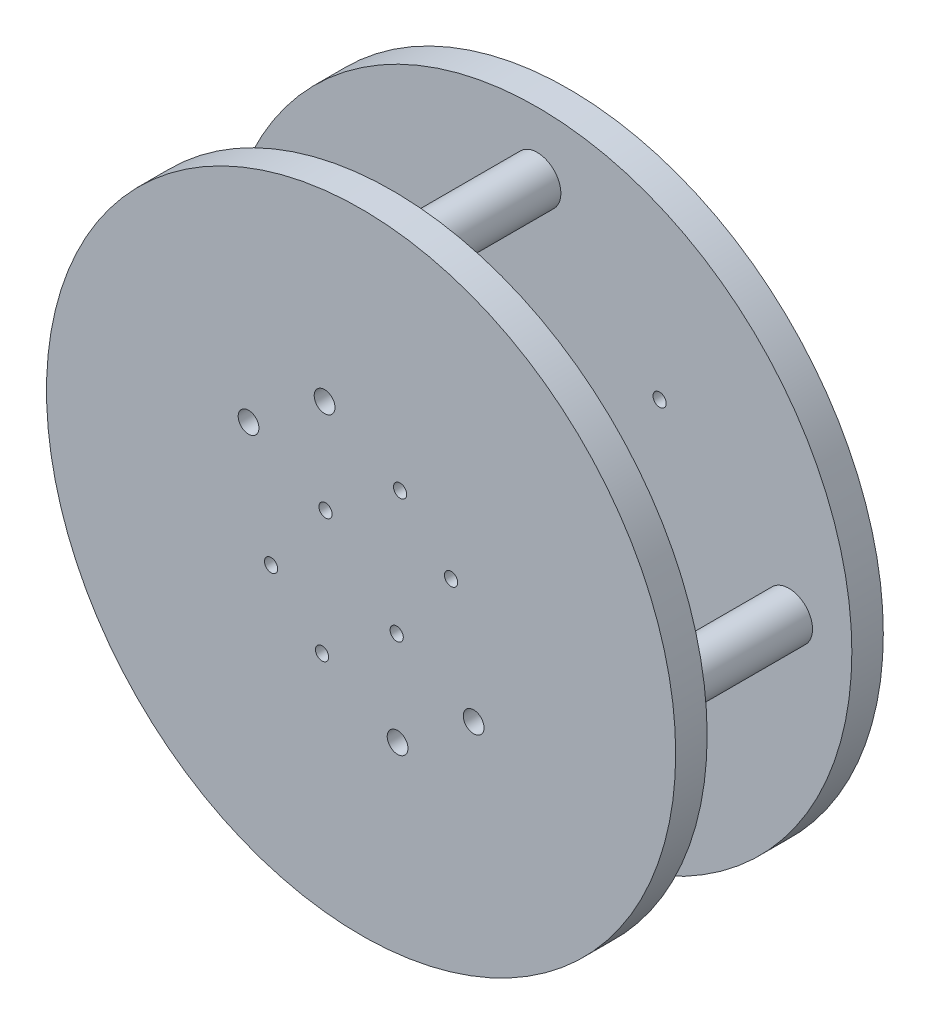
from build123d import *

# Parameters (mm, degrees)
SKETCH_1_R               = 100
EXTRUDE_1_DEPTH          = 10
SKETCH_12_R              = 7.5
EXTRUDE_3_DEPTH          = 46
SKETCH_14_R              = 100
EXTRUDE_4_DEPTH          = 10
SKETCH_15_R              = 2.1
CUT_EXTRUDE_7_DEPTH      = 10
SKETCH_15_3_R            = 2.1
CUT_EXTRUDE_8_DEPTH      = 157.064089399
SKETCH_18_R              = 3.3
CUT_EXTRUDE_9_DEPTH      = 5
HOLE_WIZARD_M5_1_D       = 4.2
HOLE_WIZARD_M5_1_DEPTH   = 10
PATTERN_CIRCULAR_1_COUNT = 4


with BuildPart() as part:
    # 草图1 → 凸台-拉伸1 (new body)
    with BuildSketch(Plane.XY):
        Circle(SKETCH_1_R)
    extrude(amount=EXTRUDE_1_DEPTH)

    # 草图12 → 凸台-拉伸3 (add)
    with BuildSketch(Plane.XY.offset(10)):
        with Locations((-80, 0)):
            Circle(SKETCH_12_R)
        with Locations((0, 80)):
            Circle(SKETCH_12_R)
        with Locations((80, 0)):
            Circle(SKETCH_12_R)
        with Locations((0, -80)):
            Circle(SKETCH_12_R)
    extrude(amount=EXTRUDE_3_DEPTH)

    # 草图14 → 凸台-拉伸4 (add)
    with BuildSketch(Plane.XY.offset(56)):
        Circle(SKETCH_14_R)
    extrude(amount=EXTRUDE_4_DEPTH)

    # 草图15 → 切除-拉伸7 (cut)
    with BuildSketch(Plane.XY.offset(66)):
        with Locations((-11.313708499, 11.313708499)):
            Circle(SKETCH_15_R)
        with Locations((11.313708499, -11.313708499)):
            Circle(SKETCH_15_R)
    extrude(amount=-CUT_EXTRUDE_7_DEPTH, mode=Mode.SUBTRACT)

    # 草图15<3> → 切除-拉伸8 (cut, through all)
    with BuildSketch(Plane.XY.offset(66)):
        with Locations((12.402652942, 28.609540367)):
            Circle(SKETCH_15_3_R)
        with Locations((28.609540367, 12.402652942)):
            Circle(SKETCH_15_3_R)
        with Locations((-12.402652942, -28.609540367)):
            Circle(SKETCH_15_3_R)
        with Locations((-28.609540367, -12.402652942)):
            Circle(SKETCH_15_3_R)
    extrude(amount=-CUT_EXTRUDE_8_DEPTH, mode=Mode.SUBTRACT)

    # 草图18 → 切除-拉伸9 (cut)
    with BuildSketch(Plane.XY.offset(66)):
        with Locations((-11.601229272, 41.114613939)):
            Circle(SKETCH_18_R)
        with Locations((-35.774918891, 23.348558378)):
            Circle(SKETCH_18_R)
        with Locations((11.601229272, -41.114613939)):
            Circle(SKETCH_18_R)
        with Locations((35.774918891, -23.348558378)):
            Circle(SKETCH_18_R)
    extrude(amount=-CUT_EXTRUDE_9_DEPTH, mode=Mode.SUBTRACT)

    # M5 螺纹孔1
    with Locations(Plane(origin=(-38.890872965, 38.890872965, 10), x_dir=(1, 0, 0), z_dir=(0, 0, 1))):
        with Locations((0, 0)):
            hole_wizard_m5_1 = Hole(HOLE_WIZARD_M5_1_D / 2, depth=HOLE_WIZARD_M5_1_DEPTH)

    # 阵列(圆周)1: M5 螺纹孔1 ×4 about axis
    pattern_circular_1_axis = Axis((0, 0, 0), (0, 0, 1))
    for i in range(1, PATTERN_CIRCULAR_1_COUNT):
        add(hole_wizard_m5_1.rotate(pattern_circular_1_axis, i * 360 / PATTERN_CIRCULAR_1_COUNT), mode=Mode.SUBTRACT)


solid = part.part
